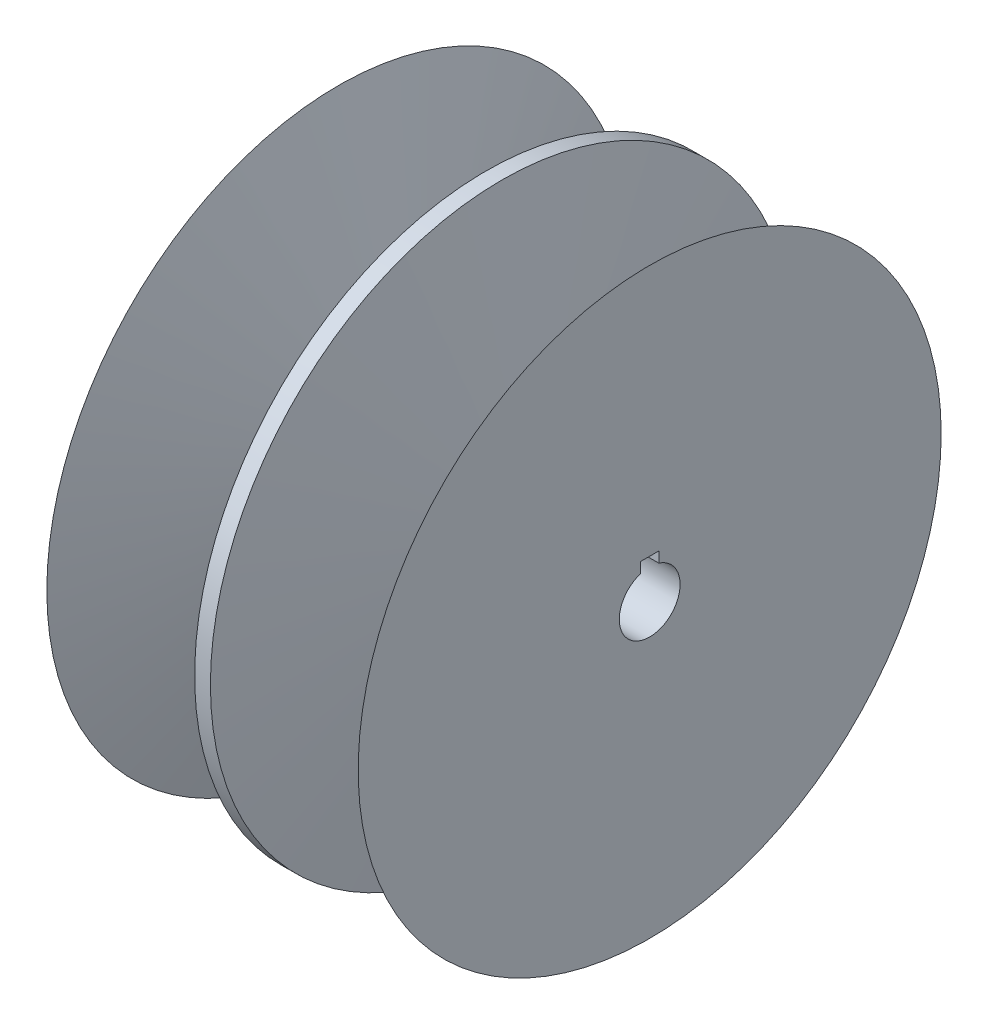
from build123d import *

# Parameters (mm, degrees)
CUT_EXTRUDE1_START = -108.204
CUT_EXTRUDE1_DEPTH = 108.204


with BuildPart() as part:
    # Sketch1 → Revolve1 (revolve)
    with BuildSketch(Plane.XY, mode=Mode.PRIVATE) as revolve1_sk:
        Polygon((-22.013333333, 12.7), (-22.013333333, 6.35), (-40.64, 6.35), (-40.64, 76.09205), align=None)
        Polygon((-9.313333333, 12.7), (-2.0574, 76.09205), (2.0574, 76.09205), (9.313333333, 12.7), (9.313333333, 6.35), (-9.313333333, 6.35), align=None)
        Polygon((22.013333333, 6.35), (40.64, 6.35), (40.64, 76.09205), (22.013333333, 12.7), align=None)
    revolve(revolve1_sk.sketch.rotate(Axis((0, 0, 0), (-1, 0, 0)), 90), axis=Axis((0, 0, 0), (-1, 0, 0)))

    # Sketch2 → Cut-Extrude1 (cut)
    with BuildSketch(Plane(origin=(40.64, 0, 0), x_dir=(0, 0, -1), z_dir=(1, 0, 0)).offset(CUT_EXTRUDE1_START)):
        with BuildLine():
            ThreePointArc((-2.38125, 5.886607549), (0, 6.35), (2.38125, 5.886607549))
            Line((2.38125, 5.886607549), (2.38125, 7.571892411))
            ThreePointArc((2.38125, 7.571892411), (0, 7.9375), (-2.38125, 7.571892411))
            Line((-2.38125, 7.571892411), (-2.38125, 5.886607549))
        make_face()
        with BuildLine():
            Line((2.38125, 7.571892411), (2.38125, 5.886607549))
            ThreePointArc((2.38125, 5.886607549), (5.265141855, 3.549757914), (6.35, 0))
            ThreePointArc((6.35, 0), (-3.549757914, -5.265141855), (-2.38125, 5.886607549))
            Line((-2.38125, 5.886607549), (-2.38125, 7.571892411))
            ThreePointArc((-2.38125, 7.571892411), (-4.695888328, -6.399417088), (7.9375, 0))
            ThreePointArc((7.9375, 0), (6.399417088, 4.695888328), (2.38125, 7.571892411))
        make_face()
        with BuildLine():
            ThreePointArc((-2.38125, 7.571892411), (0, 7.9375), (2.38125, 7.571892411))
            Line((2.38125, 7.571892411), (2.38125, 10.31875))
            Line((2.38125, 10.31875), (-2.38125, 10.31875))
            Line((-2.38125, 10.31875), (-2.38125, 7.571892411))
        make_face()
        with BuildLine():
            Line((2.38125, 5.886607549), (2.38125, 5.55625))
            Line((2.38125, 5.55625), (-2.38125, 5.55625))
            Line((-2.38125, 5.55625), (-2.38125, 5.886607549))
            ThreePointArc((-2.38125, 5.886607549), (-3.549757914, -5.265141855), (6.35, 0))
            ThreePointArc((6.35, 0), (5.265141855, 3.549757914), (2.38125, 5.886607549))
        make_face()
        with BuildLine():
            Line((-2.38125, 5.55625), (2.38125, 5.55625))
            Line((2.38125, 5.55625), (2.38125, 5.886607549))
            ThreePointArc((2.38125, 5.886607549), (0, 6.35), (-2.38125, 5.886607549))
            Line((-2.38125, 5.886607549), (-2.38125, 5.55625))
        make_face()
    extrude(amount=CUT_EXTRUDE1_DEPTH, mode=Mode.SUBTRACT)


solid = part.part
